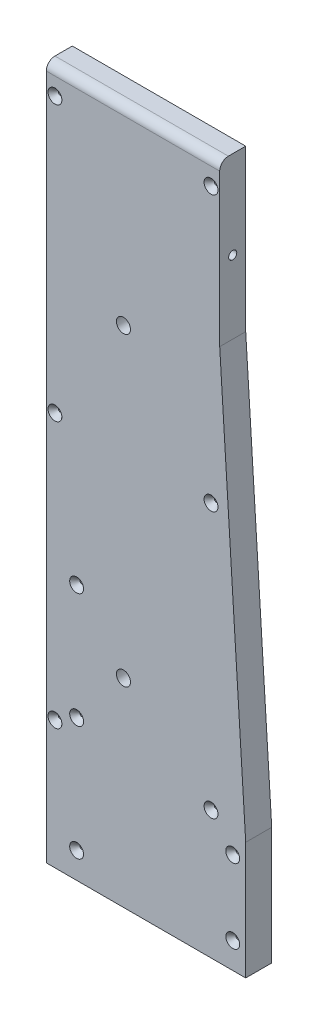
from build123d import *

# Parameters (mm, degrees)
BOSS_EXTRUDE1_DEPTH                  = 19.05
F_3_8_CLEARANCE_HOLE1_D              = 10.31748
HOLE1_D                              = 3.175
HOLE1_DEPTH                          = 50.8
HOLE1_CSINK_D                        = 10.16
HOLE1_CSINK_ANGLE                    = 82
HOLE1_TIP                            = 0.953866233
F_15_64_0_23438_DIAMETER_HOLE1_D     = 5.953252
F_15_64_0_23438_DIAMETER_HOLE1_DEPTH = 23.611462659
F_15_64_0_23438_DIAMETER_HOLE1_TIP   = 1.788537341
FILLET1_R                            = 6.35


with BuildPart() as part:
    # Sketch1 → Boss-Extrude1 (new body)
    with BuildSketch(Plane.XY):
        Polygon((82.03946, -5024.878404071), (82.03946, -5533.415502988), (228.088766336, -5533.415502988), (228.088766336, -5447.34166837), (209.03946, -5142.552766987), (209.03946, -5024.878404071), align=None)
    extrude(amount=BOSS_EXTRUDE1_DEPTH)

    # 3/8 Clearance Hole1 (through all)
    with Locations(Plane.XY.offset(19.05)):
        with Locations((138.550999994, -5387.96381451), (138.550999994, -5164.31681451)):
            Hole(F_3_8_CLEARANCE_HOLE1_D / 2)

    # Hole1
    with Locations(Plane(origin=(0, -5562.870276207, 19.05), x_dir=(1, 0, 0), z_dir=(0, 0, 1))):
        with Locations((218.563766336, 102.817509219), (218.563766336, 48.504773219), (202.68946, 123.306744588), (202.68946, 317.949308361), (202.68946, 518.941872135), (88.38946, 518.941872135), (88.38946, 317.949308361), (88.38946, 123.306744588), (104.263766336, 216.849631358), (104.263766336, 132.677202288), (104.263766336, 48.504773219), (-104.263766336, 48.504773219), (-104.263766336, 132.677202288), (-104.263766336, 216.849631358), (-88.38946, 123.306744588), (-88.38946, 317.949308361), (-88.38946, 518.941872135), (-202.68946, 518.941872135), (-202.68946, 317.949308361), (-202.68946, 123.306744588), (-218.563766336, 48.504773219), (-218.563766336, 102.817509219)):
            CounterSinkHole(HOLE1_D / 2, HOLE1_CSINK_D / 2, depth=HOLE1_DEPTH, counter_sink_angle=HOLE1_CSINK_ANGLE)
            with Locations((0, 0, -(HOLE1_DEPTH + HOLE1_TIP / 2))):  # 118° drill point
                Cone(0, HOLE1_D / 2, HOLE1_TIP, mode=Mode.SUBTRACT)

    # 15/64 (0.23438) Diameter Hole1
    with Locations(Plane(origin=(209.03946, 0, 0), x_dir=(0, 0, -1), z_dir=(1, 0, 0))):
        with Locations((-9.526574029, -5089.226125561)):
            Hole(F_15_64_0_23438_DIAMETER_HOLE1_D / 2, depth=F_15_64_0_23438_DIAMETER_HOLE1_DEPTH)
            with Locations((0, 0, -(F_15_64_0_23438_DIAMETER_HOLE1_DEPTH + F_15_64_0_23438_DIAMETER_HOLE1_TIP / 2))):  # 118° drill point
                Cone(0, F_15_64_0_23438_DIAMETER_HOLE1_D / 2, F_15_64_0_23438_DIAMETER_HOLE1_TIP, mode=Mode.SUBTRACT)

    # Fillet1
    fillet1_edges = [part.edges().sort_by_distance(p)[0] for p in [
        (145.53946, -5024.878404071, 19.05),
    ]]
    fillet(fillet1_edges, radius=FILLET1_R)


solid = part.part
